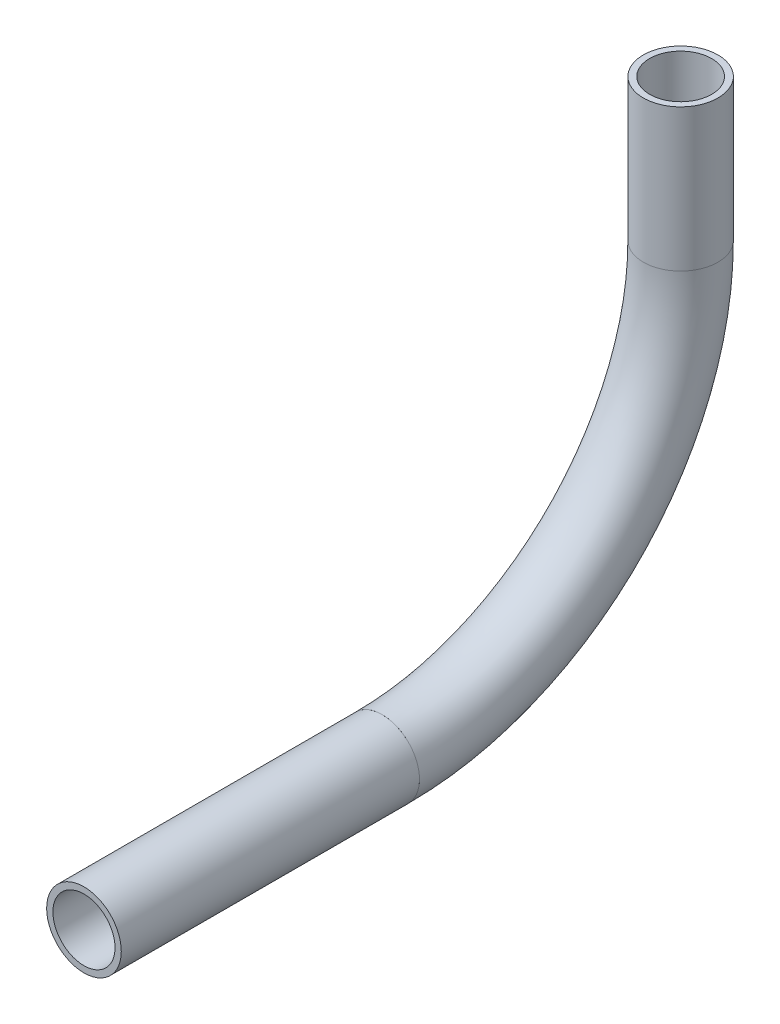
from build123d import *

# Parameters (mm, degrees)
SKETCH1_R                 = 6.35
SKETCH1_R_2               = 5.2832
PIPE_0_5_SCH_40_1_DEPTH   = 24.206758294
SKETCH1_ON_SEGMENT_2_R    = 6.35
SKETCH1_ON_SEGMENT_2_R_2  = 5.2832
PIPE_0_5_SCH_40_1_2_ANGLE = 90
SKETCH1_ON_SEGMENT_3_R    = 6.35
SKETCH1_ON_SEGMENT_3_R_2  = 5.2832
PIPE_0_5_SCH_40_1_3_DEPTH = 50.748068919


with BuildPart() as part:
    # Sketch1 → Pipe 0.5 SCH 40(1) (new body)
    with BuildSketch(Plane(origin=(0, -201.573709624, 259.179579455), x_dir=(0, 0, -1), z_dir=(0, -1, 0))):
        Circle(SKETCH1_R)
        Circle(SKETCH1_R_2, mode=Mode.SUBTRACT)
    extrude(amount=PIPE_0_5_SCH_40_1_DEPTH)


with BuildPart() as body_2:
    # Sketch1 on segment 2 (carried to the start of arc 2) → Pipe 0.5 SCH 40_1 2 (revolve)
    with BuildSketch(Plane(origin=(0, -225.780467918, 259.179579455), x_dir=(0, 0, -1), z_dir=(0, -1, 0))):
        Circle(SKETCH1_ON_SEGMENT_2_R)
        Circle(SKETCH1_ON_SEGMENT_2_R_2, mode=Mode.SUBTRACT)
    revolve(axis=Axis((0, -225.780467918, 309.979579455), (-1, 0, 0)), revolution_arc=PIPE_0_5_SCH_40_1_2_ANGLE)


with BuildPart() as body_3:
    # Sketch1 on segment 3 (carried to segment 3) → Pipe 0.5 SCH 40_1 3 (new body)
    with BuildSketch(Plane(origin=(0, -276.580467918, 309.979579455), x_dir=(0, -1, 0), z_dir=(0, 0, 1))):
        Circle(SKETCH1_ON_SEGMENT_3_R)
        Circle(SKETCH1_ON_SEGMENT_3_R_2, mode=Mode.SUBTRACT)
    extrude(amount=PIPE_0_5_SCH_40_1_3_DEPTH)


solid = Compound([part.part, body_2.part, body_3.part])
